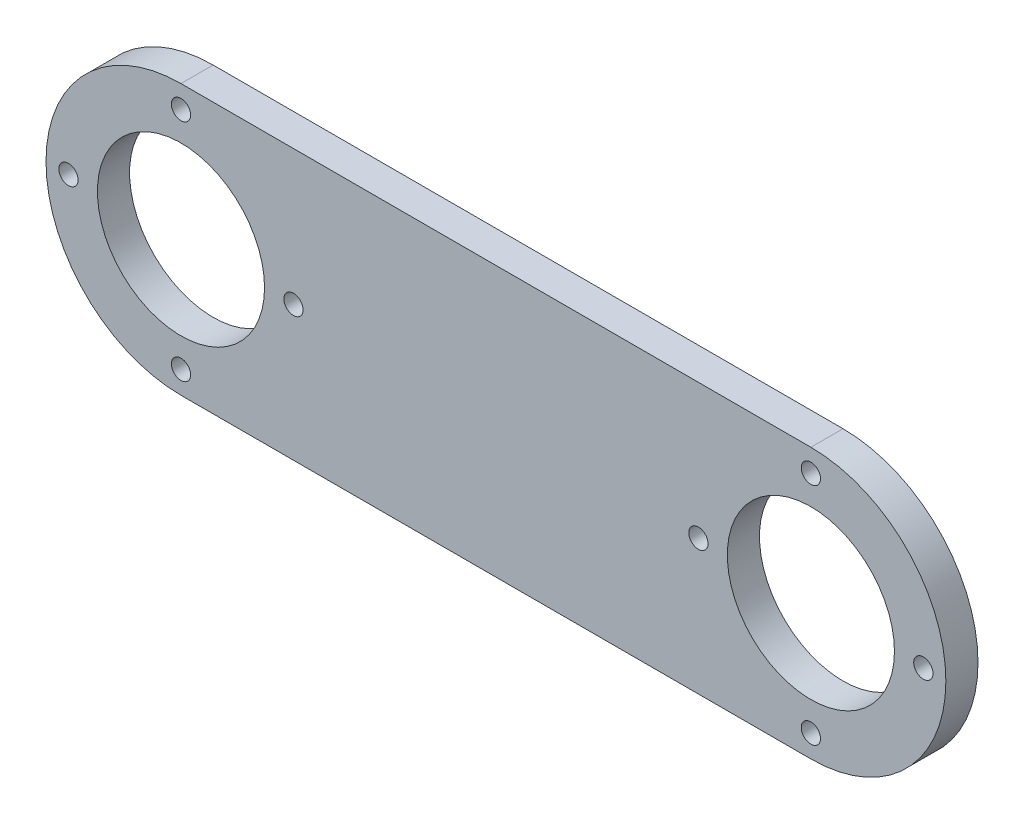
from build123d import *

# Parameters (mm, degrees)
SKETCH1_R           = 1.5
SKETCH1_R_2         = 13
BOSS_EXTRUDE1_DEPTH = 5


with BuildPart() as part:
    # Sketch1 → Boss-Extrude1 (new body)
    with BuildSketch(Plane.XY):
        with BuildLine():
            Line((-49, 26), (49, 26))
            ThreePointArc((49, 26), (70, 5), (49, -16))
            Line((49, -16), (-49, -16))
            ThreePointArc((-49, -16), (-70, 5), (-49, 26))
        make_face()
        with Locations((49, -12.5)):
            Circle(SKETCH1_R, mode=Mode.SUBTRACT)
        with Locations((66.5, 5)):
            Circle(SKETCH1_R, mode=Mode.SUBTRACT)
        with Locations((31.5, 5)):
            Circle(SKETCH1_R, mode=Mode.SUBTRACT)
        with Locations((49, 22.5)):
            Circle(SKETCH1_R, mode=Mode.SUBTRACT)
        with Locations((-49, -12.5)):
            Circle(SKETCH1_R, mode=Mode.SUBTRACT)
        with Locations((-31.5, 5)):
            Circle(SKETCH1_R, mode=Mode.SUBTRACT)
        with Locations((-66.5, 5)):
            Circle(SKETCH1_R, mode=Mode.SUBTRACT)
        with Locations((-49, 22.5)):
            Circle(SKETCH1_R, mode=Mode.SUBTRACT)
        with Locations((-49, 5)):
            Circle(SKETCH1_R_2, mode=Mode.SUBTRACT)
        with Locations((49, 5)):
            Circle(SKETCH1_R_2, mode=Mode.SUBTRACT)
    extrude(amount=BOSS_EXTRUDE1_DEPTH)


solid = part.part
